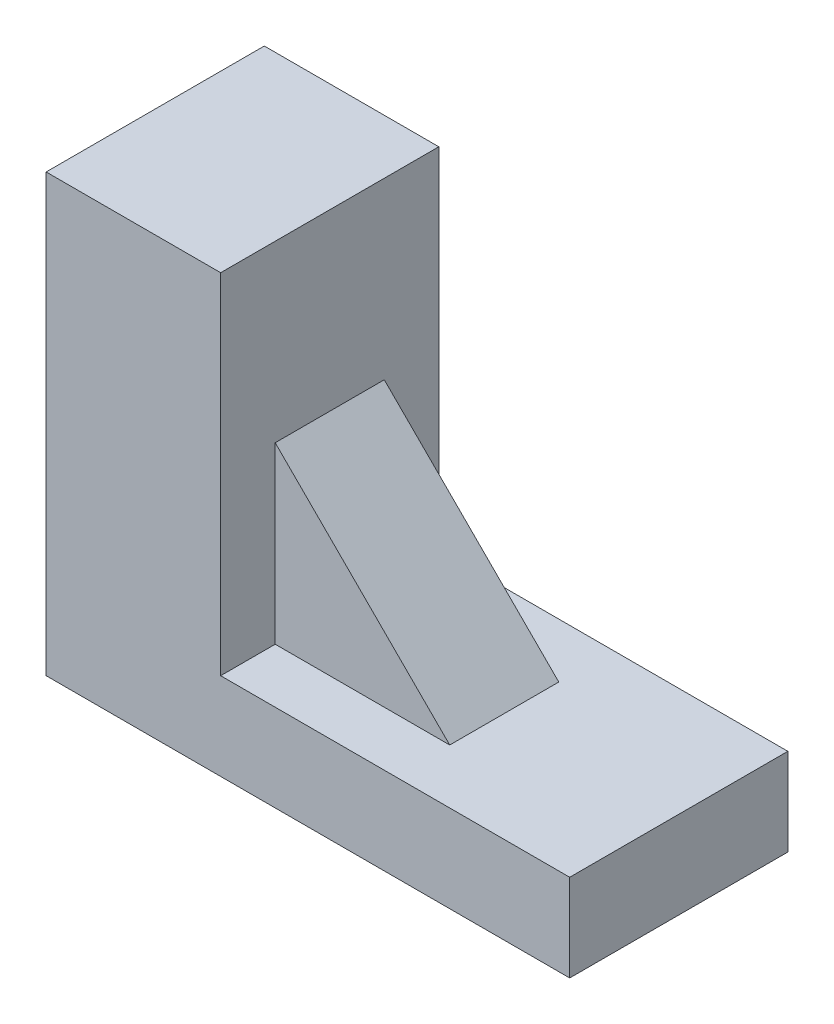
from build123d import *

# Parameters (mm, degrees)
EXTRUDE_1_DEPTH  = 10
RIB_29_REACH     = 33.639
SKETCH_20_WALL_W = 76.590876578
SKETCH_20_WALL_H = 5


with BuildPart() as part:
    # 草图4 → 凸台-拉伸1 (new body)
    with BuildSketch(Plane.XY):
        Polygon((0, 0), (0, -20), (24, -20), (24, -16), (8, -16), (8, 0), align=None)
    extrude(amount=-EXTRUDE_1_DEPTH)

    # 草图20 wall → 筋29 (add, up to next)
    with BuildSketch(Plane(origin=(12, -12, -5), x_dir=(0.707106781187, -0.707106781187, 0), z_dir=(0.707106781187, 0.707106781187, 0)), mode=Mode.PRIVATE) as rib_29_sk1:
        Rectangle(SKETCH_20_WALL_W, SKETCH_20_WALL_H)
    rib_29_tool1 = extrude(rib_29_sk1.sketch, amount=-RIB_29_REACH, mode=Mode.PRIVATE) - part.part
    add(rib_29_tool1.solids().sort_by_distance((12, -12, -5))[0])


solid = part.part
